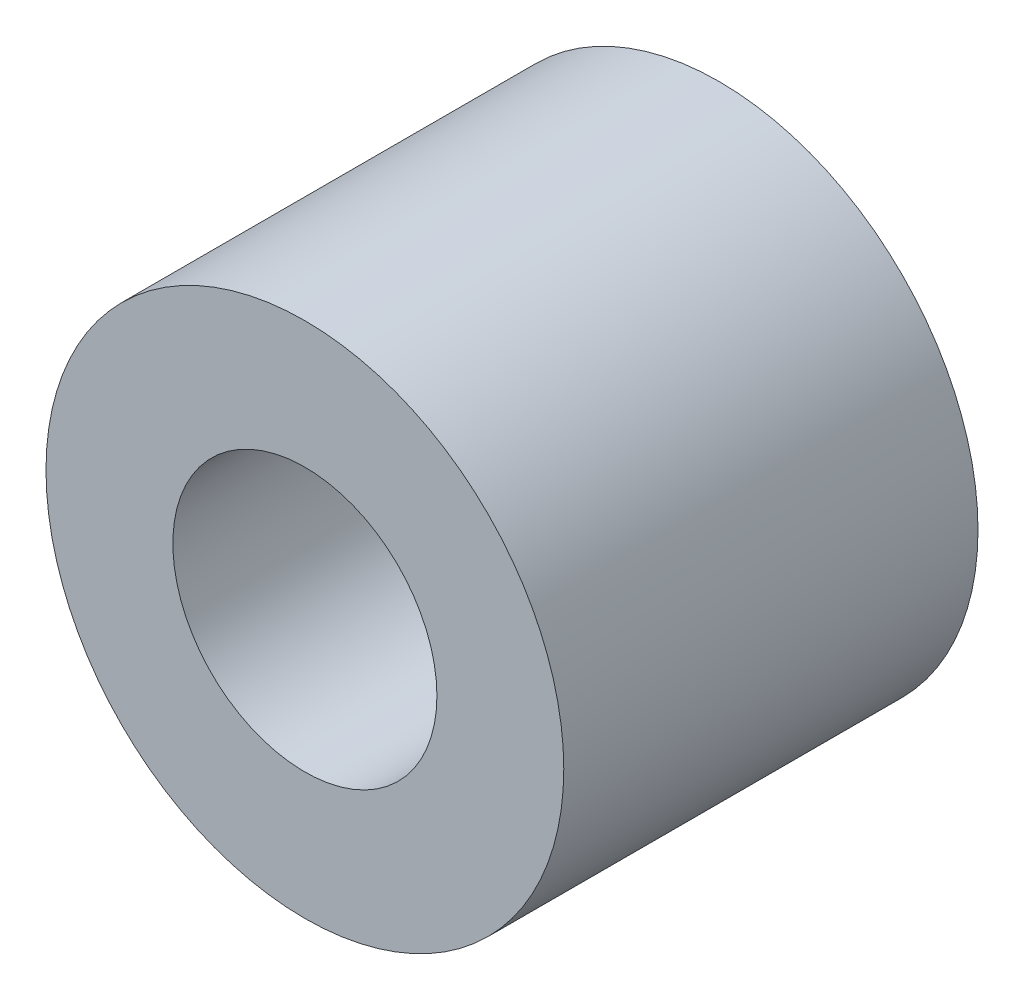
from build123d import *

# Parameters (mm, degrees)
SKETCH5_W          = 16
SKETCH5_H          = 10
SKETCH7_R          = 5.1
CUT_EXTRUDE1_DEPTH = 22.354156504


with BuildPart() as part:
    # Sketch5 → Revolve1 (revolve)
    with BuildSketch(Plane(origin=(0, 0, 0), x_dir=(0, 0, -1), z_dir=(0, 1, 0)), mode=Mode.PRIVATE) as revolve1_sk:
        with Locations((0, 5)):
            Rectangle(SKETCH5_W, SKETCH5_H)
    revolve(revolve1_sk.sketch.rotate(Axis((0, 0, 8), (0, 0, -1)), 180), axis=Axis((0, 0, 8), (0, 0, -1)))

    # Sketch7 → Cut-Extrude1 (cut, through all)
    with BuildSketch(Plane.XY.offset(8)):
        Circle(SKETCH7_R)
    extrude(amount=-CUT_EXTRUDE1_DEPTH, mode=Mode.SUBTRACT)


solid = part.part
